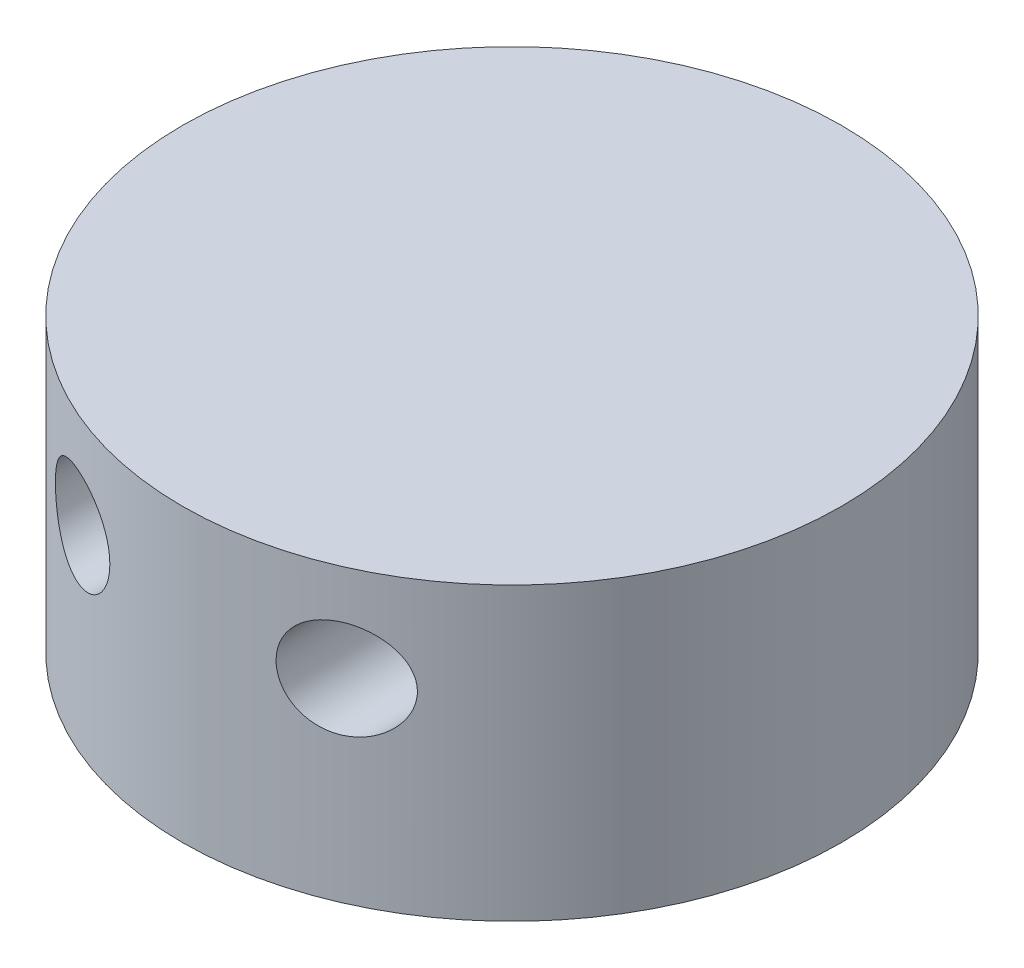
from build123d import *

# Parameters (mm, degrees)
SKETCH1_R      = 21.5646
EXTRUDE1_DEPTH = 19.05
SKETCH5_R      = 3.2004
EXTRUDE2_DEPTH = 52.867658269


with BuildPart() as part:
    # Sketch1 → Extrude1 (new body)
    with BuildSketch(Plane(origin=(0, 0, 0), x_dir=(1, 0, 0), z_dir=(0, 1, 0))):
        Circle(SKETCH1_R)
    extrude(amount=-EXTRUDE1_DEPTH)

    # Sketch5 → Extrude2 (cut, through all)
    with BuildSketch(Plane.XY.offset(-21.59)):
        with Locations((8.637124479, -6.35)):
            Circle(SKETCH5_R)
        with Locations((-8.637124479, -6.35)):
            Circle(SKETCH5_R)
    extrude(amount=EXTRUDE2_DEPTH, mode=Mode.SUBTRACT)


solid = part.part
